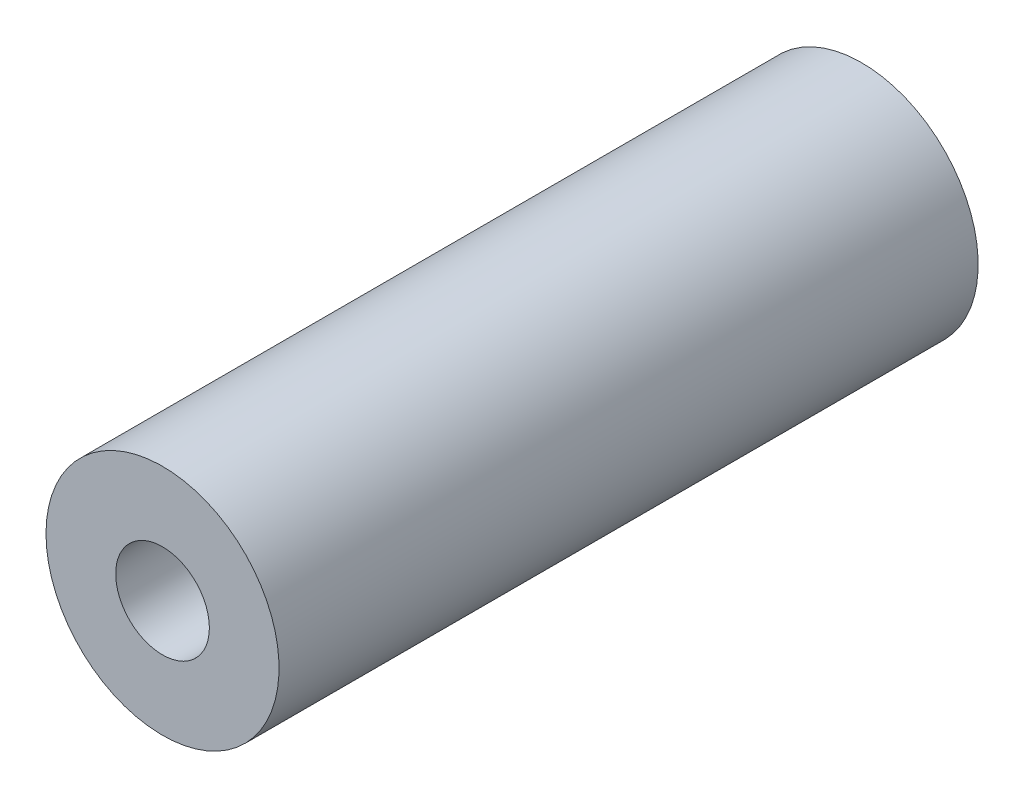
from build123d import *

# Parameters (mm, degrees)
SKETCH1_R                   = 6.35
HANDLE_BASE_DEPTH           = 38.1
F_1_4_20_TAPPED_HOLE1_D     = 5.1054
F_1_4_20_TAPPED_HOLE1_DEPTH = 22.596183098
F_1_4_20_TAPPED_HOLE1_TIP   = 1.533816902
SKETCH2_R                   = 2.5527
CUT_EXTRUDE1_DEPTH          = 40.144028919


with BuildPart() as part:
    # Sketch1 → Handle Base (new body)
    with BuildSketch(Plane.XY):
        with Locations(Location((0, 0, 0), (0, 0, 180))):
            Circle(SKETCH1_R)
    extrude(amount=HANDLE_BASE_DEPTH)

    # 1/4-20 Tapped Hole1
    with Locations(Plane.XY.offset(38.1)):
        with Locations((0, 0)):
            Hole(F_1_4_20_TAPPED_HOLE1_D / 2, depth=F_1_4_20_TAPPED_HOLE1_DEPTH)
            with Locations((0, 0, -(F_1_4_20_TAPPED_HOLE1_DEPTH + F_1_4_20_TAPPED_HOLE1_TIP / 2))):  # 118° drill point
                Cone(0, F_1_4_20_TAPPED_HOLE1_D / 2, F_1_4_20_TAPPED_HOLE1_TIP, mode=Mode.SUBTRACT)

    # Sketch2 → Cut-Extrude1 (cut, through all)
    with BuildSketch(Plane.XY.offset(38.1)):
        Circle(SKETCH2_R)
    extrude(amount=-CUT_EXTRUDE1_DEPTH, mode=Mode.SUBTRACT)


solid = part.part
